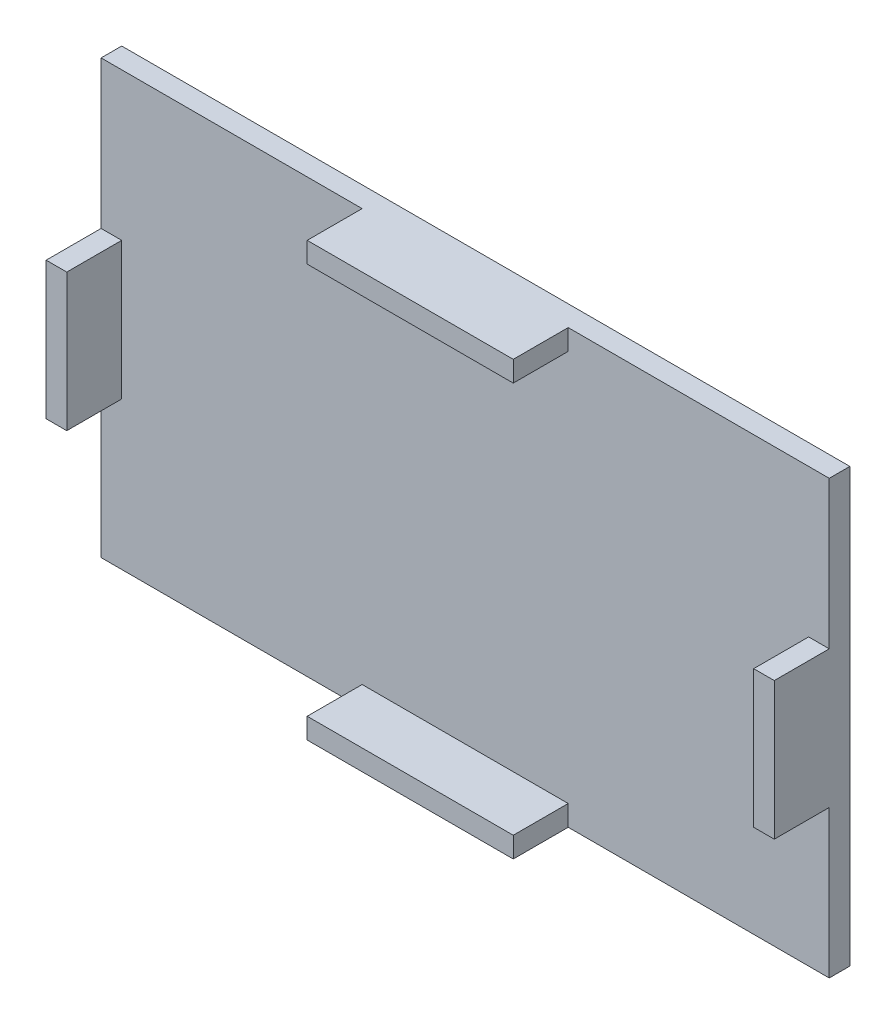
from build123d import *

# Parameters (mm, degrees)
SKETCH1_W           = 53
SKETCH1_H           = 31.5
BOSS_EXTRUDE1_DEPTH = 1.5
SKETCH2_W           = 1.5
SKETCH2_H           = 10
SKETCH2_W_2         = 15
SKETCH2_H_2         = 1.5
BOSS_EXTRUDE2_DEPTH = 4


with BuildPart() as part:
    # Sketch1 → Boss-Extrude1 (new body)
    with BuildSketch(Plane.XY):
        with Locations((26.5, 15.75)):
            Rectangle(SKETCH1_W, SKETCH1_H)
    extrude(amount=BOSS_EXTRUDE1_DEPTH)

    # Sketch2 → Boss-Extrude2 (add)
    with BuildSketch(Plane.XY.offset(1.5)):
        with Locations((0.75, 15.75)):
            Rectangle(SKETCH2_W, SKETCH2_H)
        with Locations((26.5, 30.75)):
            Rectangle(SKETCH2_W_2, SKETCH2_H_2)
        with Locations((52.25, 15.75)):
            Rectangle(SKETCH2_W, SKETCH2_H)
        with Locations((26.5, 0.75)):
            Rectangle(SKETCH2_W_2, SKETCH2_H_2)
    extrude(amount=BOSS_EXTRUDE2_DEPTH)


solid = part.part
